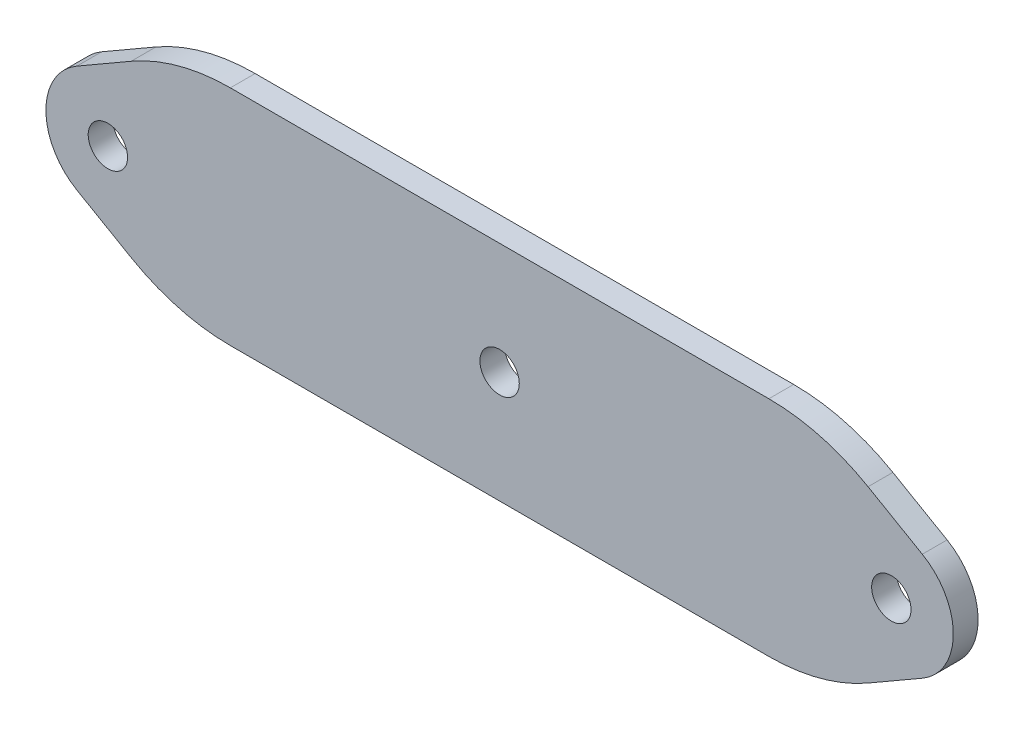
from build123d import *

# Parameters (mm, degrees)
SKETCH1_R           = 3.96875
BOSS_EXTRUDE2_DEPTH = 5


with BuildPart() as part:
    # Sketch1 → Boss-Extrude2 (new body)
    with BuildSketch(Plane.XY):
        with BuildLine():
            Line((-54.282032303, 22.5), (54.282032303, 22.5))
            ThreePointArc((54.282032303, 22.5), (64.634794107, 21.137033052), (74.282032303, 17.141016151))
            Line((74.282032303, 17.141016151), (85.22114317, 10.825317547))
            ThreePointArc((85.22114317, 10.825317547), (91.47114317, 0), (85.22114317, -10.825317547))
            Line((85.22114317, -10.825317547), (74.282032303, -17.141016151))
            ThreePointArc((74.282032303, -17.141016151), (64.634794107, -21.137033052), (54.282032303, -22.5))
            Line((54.282032303, -22.5), (-54.282032303, -22.5))
            ThreePointArc((-54.282032303, -22.5), (-64.634794107, -21.137033052), (-74.282032303, -17.141016151))
            Line((-74.282032303, -17.141016151), (-85.22114317, -10.825317547))
            ThreePointArc((-85.22114317, -10.825317547), (-91.47114317, 0), (-85.22114317, 10.825317547))
            Line((-85.22114317, 10.825317547), (-74.282032303, 17.141016151))
            ThreePointArc((-74.282032303, 17.141016151), (-64.634794107, 21.137033052), (-54.282032303, 22.5))
        make_face()
        with Locations((-78.97114317, 0)):
            Circle(SKETCH1_R, mode=Mode.SUBTRACT)
        with Locations((78.97114317, 0)):
            Circle(SKETCH1_R, mode=Mode.SUBTRACT)
        Circle(SKETCH1_R, mode=Mode.SUBTRACT)
    extrude(amount=BOSS_EXTRUDE2_DEPTH)


solid = part.part
